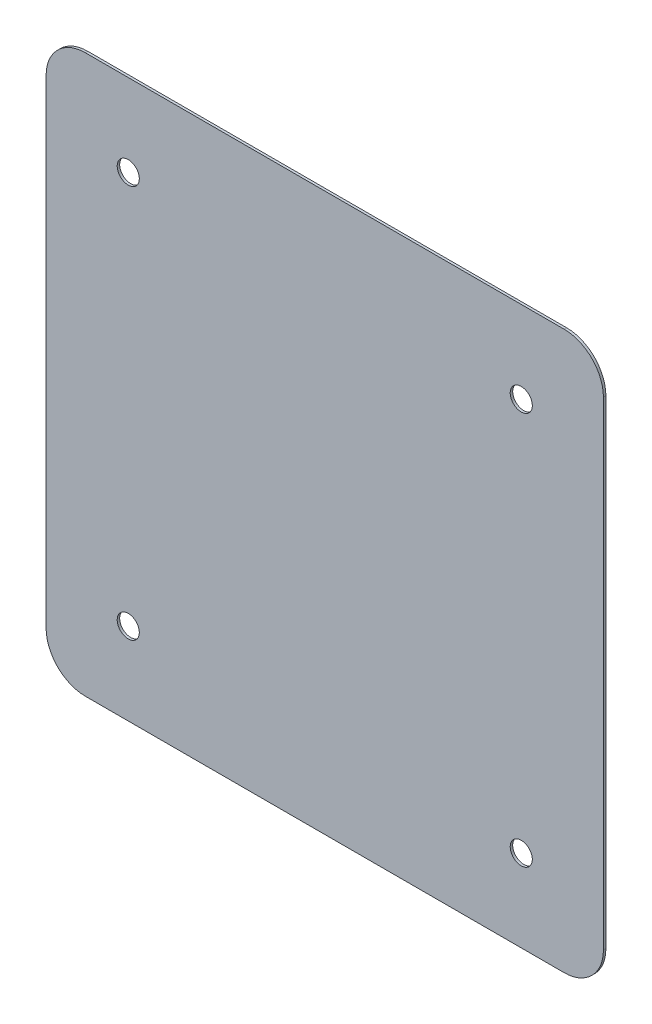
from build123d import *

# Parameters (mm, degrees)
SKETCH1_R           = 3.57
BOSS_EXTRUDE1_DEPTH = 0.8


with BuildPart() as part:
    # Sketch1 → Boss-Extrude1 (new body)
    with BuildSketch(Plane.XY):
        with BuildLine():
            Line((-77.343, 90.043), (77.343, 90.043))
            ThreePointArc((77.343, 90.043), (86.323256121, 86.323256121), (90.043, 77.343))
            Line((90.043, 77.343), (90.043, -77.343))
            ThreePointArc((90.043, -77.343), (86.323256121, -86.323256121), (77.343, -90.043))
            Line((77.343, -90.043), (-77.343, -90.043))
            ThreePointArc((-77.343, -90.043), (-86.323256121, -86.323256121), (-90.043, -77.343))
            Line((-90.043, -77.343), (-90.043, 77.343))
            ThreePointArc((-90.043, 77.343), (-86.323256121, 86.323256121), (-77.343, 90.043))
        make_face()
        with Locations((-63.5, 63.5)):
            Circle(SKETCH1_R, mode=Mode.SUBTRACT)
        with Locations((63.5, 63.5)):
            Circle(SKETCH1_R, mode=Mode.SUBTRACT)
        with Locations((63.5, -63.5)):
            Circle(SKETCH1_R, mode=Mode.SUBTRACT)
        with Locations((-63.5, -63.5)):
            Circle(SKETCH1_R, mode=Mode.SUBTRACT)
    extrude(amount=BOSS_EXTRUDE1_DEPTH)


solid = part.part
